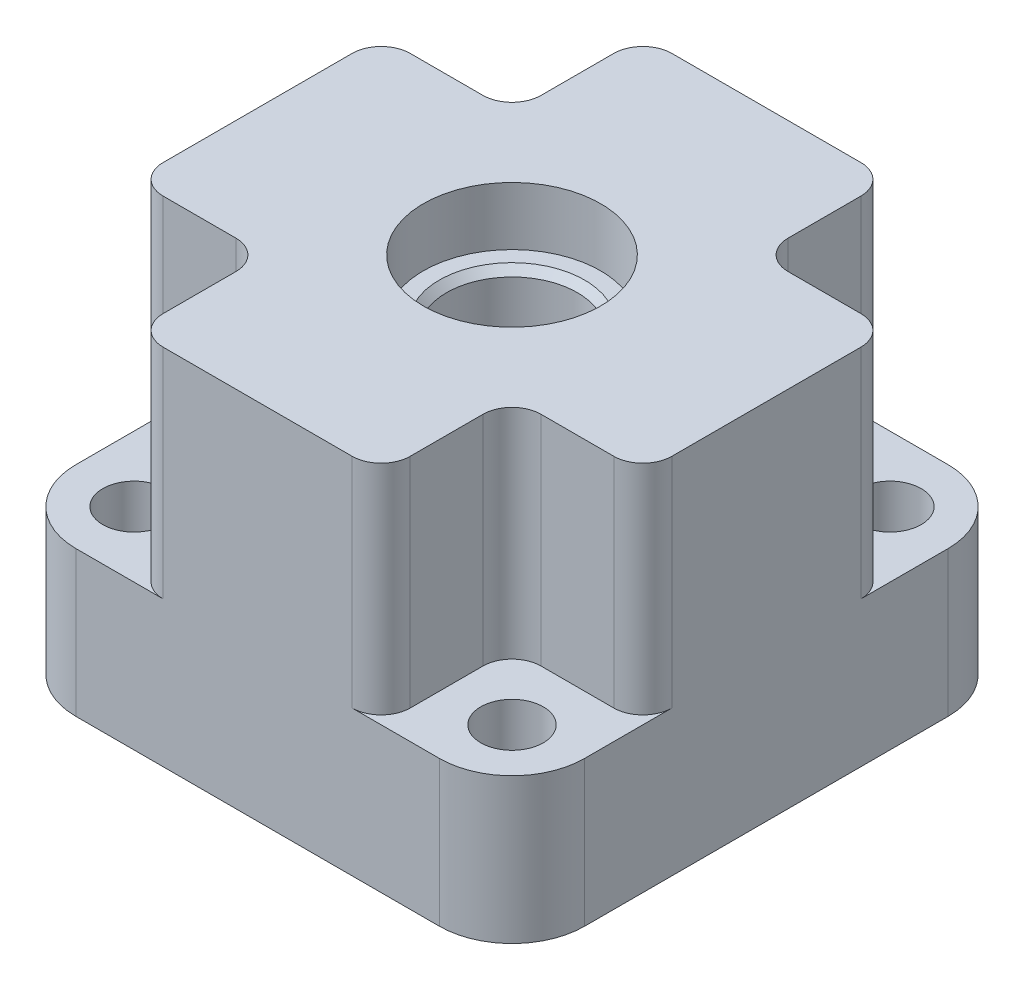
from build123d import *

# Parameters (mm, degrees)
SKETCH_1_W          = 35
SKETCH_1_H          = 35
SKETCH_1_R          = 4.5
SKETCH_1_R_2        = 2.15
EXTRUDE_1_DEPTH     = 25
FILLET_1_R          = 5
SKETCH_3_R          = 6.1
CUT_EXTRUDE_1_DEPTH = 4
SKETCH_4_R          = 6.1
CUT_EXTRUDE_2_DEPTH = 4
SKETCH_6_R          = 10
CUT_EXTRUDE_3_DEPTH = 9
SKETCH_7_W          = 9
SKETCH_7_H          = 9
CUT_EXTRUDE_4_DEPTH = 15
FILLET_3_R          = 2
CHAMFER_1_SIZE      = 1
CHAMFER_2_SIZE      = 0.5


with BuildPart() as part:
    # 草图1 → 凸台-拉伸1 (new body)
    with BuildSketch(Plane(origin=(0, 0, 0), x_dir=(1, 0, 0), z_dir=(0, 1, 0))):
        Rectangle(SKETCH_1_W, SKETCH_1_H)
        with Locations(Location((0, 0, 0), (0, 0, 270))):
            Circle(SKETCH_1_R, mode=Mode.SUBTRACT)
        with Locations(Location((13, 13, 0), (0, 0, 270))):
            Circle(SKETCH_1_R_2, mode=Mode.SUBTRACT)
        with Locations(Location((13, -13, 0), (0, 0, 270))):
            Circle(SKETCH_1_R_2, mode=Mode.SUBTRACT)
        with Locations(Location((-13, -13, 0), (0, 0, 270))):
            Circle(SKETCH_1_R_2, mode=Mode.SUBTRACT)
        with Locations(Location((-13, 13, 0), (0, 0, 270))):
            Circle(SKETCH_1_R_2, mode=Mode.SUBTRACT)
    extrude(amount=EXTRUDE_1_DEPTH)

    # 圆角1
    fillet_1_edges = [part.edges().sort_by_distance(p)[0] for p in [
        (17.5, 12.5, 17.5),
        (-17.5, 12.5, 17.5),
        (-17.5, 12.5, -17.5),
        (17.5, 12.5, -17.5),
    ]]
    fillet(fillet_1_edges, radius=FILLET_1_R)

    # 草图3 → 切除-拉伸1 (cut)
    with BuildSketch(Plane(origin=(0, 25, 0), x_dir=(1, 0, 0), z_dir=(0, 1, 0))):
        with Locations(Location((0, 0, 0), (0, 0, 270))):
            Circle(SKETCH_3_R)
    extrude(amount=-CUT_EXTRUDE_1_DEPTH, mode=Mode.SUBTRACT)

    # 草图4 → 切除-拉伸2 (cut)
    with BuildSketch(Plane(origin=(0, 13, 0), x_dir=(1, 0, 0), z_dir=(0, 1, 0))):
        with Locations(Location((0, 0, 0), (0, 0, 270))):
            Circle(SKETCH_4_R)
    extrude(amount=-CUT_EXTRUDE_2_DEPTH, mode=Mode.SUBTRACT)

    # 草图6 → 切除-拉伸3 (cut)
    with BuildSketch(Plane.XZ):
        with Locations(Location((0, 0, 0), (0, 0, 270))):
            Circle(SKETCH_6_R)
    extrude(amount=-CUT_EXTRUDE_3_DEPTH, mode=Mode.SUBTRACT)

    # 草图7 → 切除-拉伸4 (cut)
    with BuildSketch(Plane(origin=(0, 25, 0), x_dir=(1, 0, 0), z_dir=(0, 1, 0))):
        with Locations((-13, 13)):
            Rectangle(SKETCH_7_W, SKETCH_7_H)
        with Locations((13, 13)):
            Rectangle(SKETCH_7_W, SKETCH_7_H)
        with Locations((13, -13)):
            Rectangle(SKETCH_7_W, SKETCH_7_H)
        with Locations((-13, -13)):
            Rectangle(SKETCH_7_W, SKETCH_7_H)
    extrude(amount=-CUT_EXTRUDE_4_DEPTH, mode=Mode.SUBTRACT)

    # 圆角3
    fillet_3_edges = [part.edges().sort_by_distance(p)[0] for p in [
        (-17.5, 17.5, 8.5),
        (-8.5, 17.5, 8.5),
        (-8.5, 17.5, 17.5),
        (8.5, 17.5, 17.5),
        (8.5, 17.5, 8.5),
        (17.5, 17.5, 8.5),
        (17.5, 17.5, -8.5),
        (8.5, 17.5, -8.5),
        (8.5, 17.5, -17.5),
        (-8.5, 17.5, -17.5),
        (-8.5, 17.5, -8.5),
        (-17.5, 17.5, -8.5),
    ]]
    fillet(fillet_3_edges, radius=FILLET_3_R)

    # 倒角1
    chamfer_1_edges = [part.edges().sort_by_distance(p)[0] for p in [
        (0, 0, 10),
    ]]
    chamfer(chamfer_1_edges, length=CHAMFER_1_SIZE)

    # 倒角2
    chamfer_2_edges = [part.edges().sort_by_distance(p)[0] for p in [
        (0, 21, -4.5),
        (0, 13, -4.5),
    ]]
    chamfer(chamfer_2_edges, length=CHAMFER_2_SIZE)


solid = part.part
